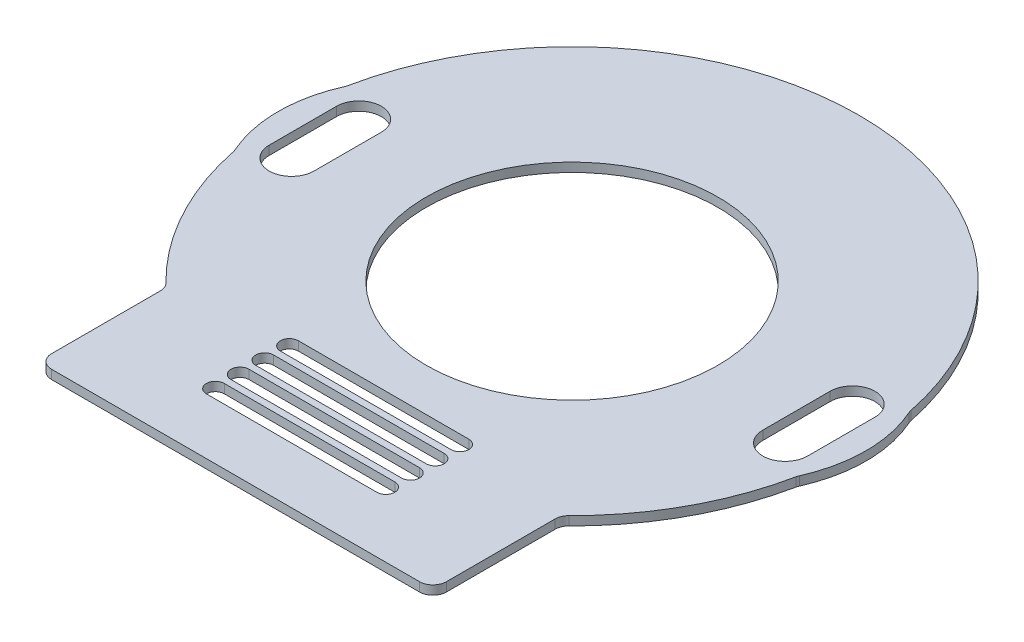
from build123d import *

# Parameters (mm, degrees)
SKETCH1_R           = 32.5
BOSS_EXTRUDE1_DEPTH = 2


with BuildPart() as part:
    # Sketch1 → Boss-Extrude1 (new body)
    with BuildSketch(Plane(origin=(0, 0, 0), x_dir=(1, 0, 0), z_dir=(0, 1, 0))):
        with BuildLine():
            Line((-41, -75), (41, -75))
            ThreePointArc((41, -75), (43.121320344, -74.121320344), (44, -72))
            Line((44, -72), (44, -47.749345545))
            ThreePointArc((44, -47.749345545), (44.232922766, -46.590344431), (44.895522388, -45.611315148))
            ThreePointArc((44.895522388, -45.611315148), (56.240897341, -30.544417924), (62.701869476, -12.824802695))
            ThreePointArc((62.701869476, -12.824802695), (62.784364017, -12.509712717), (62.900531241, -12.20542302))
            ThreePointArc((62.900531241, -12.20542302), (65.495647572, 0), (62.900531241, 12.20542302))
            ThreePointArc((62.900531241, 12.20542302), (62.784364017, 12.509712717), (62.701869476, 12.824802695))
            ThreePointArc((62.701869476, 12.824802695), (0, 64), (-62.701869476, 12.824802695))
            ThreePointArc((-62.701869476, 12.824802695), (-62.784364017, 12.509712717), (-62.900531241, 12.20542302))
            ThreePointArc((-62.900531241, 12.20542302), (-65.495647572, 0), (-62.900531241, -12.20542302))
            ThreePointArc((-62.900531241, -12.20542302), (-62.784364017, -12.509712717), (-62.701869476, -12.824802695))
            ThreePointArc((-62.701869476, -12.824802695), (-56.240897341, -30.544417924), (-44.895522388, -45.611315148))
            ThreePointArc((-44.895522388, -45.611315148), (-44.232922766, -46.590344431), (-44, -47.749345545))
            Line((-44, -47.749345545), (-44, -72))
            ThreePointArc((-44, -72), (-43.121320344, -74.121320344), (-41, -75))
        make_face()
        with Locations(Location((0, 0, 0), (0, 0, 270))):
            Circle(SKETCH1_R, mode=Mode.SUBTRACT)
        with BuildLine():
            Line((-50, 7.5), (-50, -7.5))
            ThreePointArc((-50, -7.5), (-55, -12.5), (-60, -7.5))
            Line((-60, -7.5), (-60, 7.5))
            ThreePointArc((-60, 7.5), (-55, 12.5), (-50, 7.5))
        make_face(mode=Mode.SUBTRACT)
        with BuildLine():
            Line((50, 7.5), (50, -7.5))
            ThreePointArc((50, -7.5), (55, -12.5), (60, -7.5))
            Line((60, -7.5), (60, 7.5))
            ThreePointArc((60, 7.5), (55, 12.5), (50, 7.5))
        make_face(mode=Mode.SUBTRACT)
        with BuildLine():
            Line((-19, -42), (19, -42))
            ThreePointArc((19, -42), (21, -44), (19, -46))
            Line((19, -46), (-19, -46))
            ThreePointArc((-19, -46), (-21, -44), (-19, -42))
        make_face(mode=Mode.SUBTRACT)
        with BuildLine():
            Line((-19, -47.5), (19, -47.5))
            ThreePointArc((19, -47.5), (21, -49.5), (19, -51.5))
            Line((19, -51.5), (-19, -51.5))
            ThreePointArc((-19, -51.5), (-21, -49.5), (-19, -47.5))
        make_face(mode=Mode.SUBTRACT)
        with BuildLine():
            Line((-19, -53), (19, -53))
            ThreePointArc((19, -53), (21, -55), (19, -57))
            Line((19, -57), (-19, -57))
            ThreePointArc((-19, -57), (-21, -55), (-19, -53))
        make_face(mode=Mode.SUBTRACT)
        with BuildLine():
            Line((-19, -58.5), (19, -58.5))
            ThreePointArc((19, -58.5), (21, -60.5), (19, -62.5))
            Line((19, -62.5), (-19, -62.5))
            ThreePointArc((-19, -62.5), (-21, -60.5), (-19, -58.5))
        make_face(mode=Mode.SUBTRACT)
    extrude(amount=BOSS_EXTRUDE1_DEPTH)


solid = part.part
